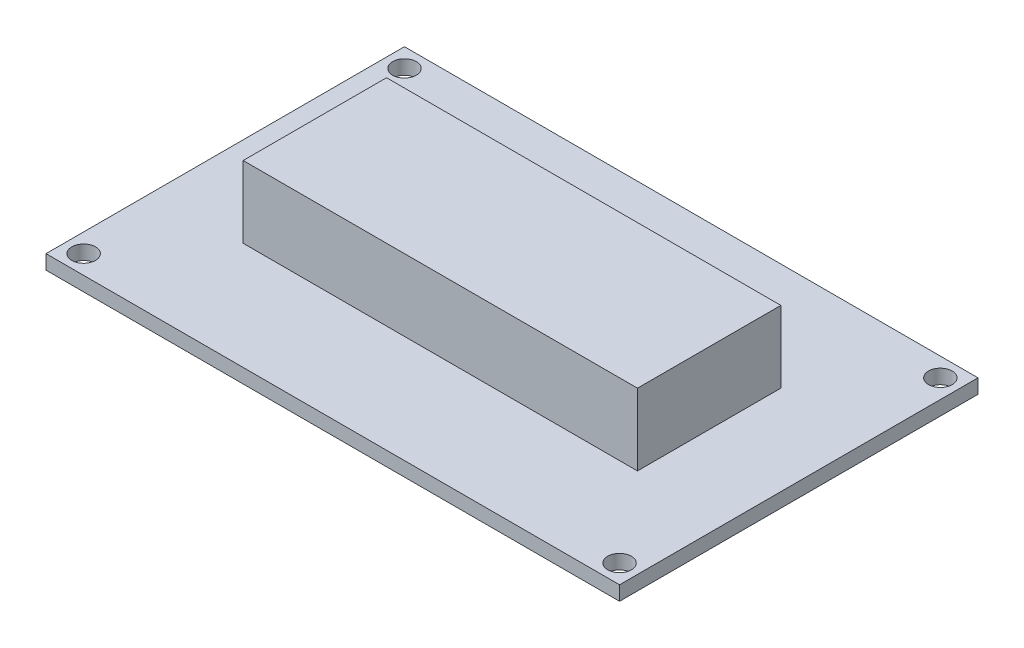
from build123d import *

# Parameters (mm, degrees)
SKETCH1_W           = 80
SKETCH1_H           = 50
SKETCH1_R           = 1.65
BOSS_EXTRUDE1_DEPTH = 2
SKETCH2_W           = 55
SKETCH2_H           = 20
BOSS_EXTRUDE2_DEPTH = 10


with BuildPart() as part:
    # Sketch1 → Boss-Extrude1 (new body)
    with BuildSketch(Plane(origin=(0, 0, 0), x_dir=(1, 0, 0), z_dir=(0, 1, 0))):
        with Locations((40, 25)):
            Rectangle(SKETCH1_W, SKETCH1_H)
        with Locations(Location((2.625, 2.625, 0), (0, 0, 270))):
            Circle(SKETCH1_R, mode=Mode.SUBTRACT)
        with Locations(Location((77.375, 2.625, 0), (0, 0, 270))):
            Circle(SKETCH1_R, mode=Mode.SUBTRACT)
        with Locations(Location((2.625, 47.375, 0), (0, 0, 270))):
            Circle(SKETCH1_R, mode=Mode.SUBTRACT)
        with Locations(Location((77.375, 47.375, 0), (0, 0, 270))):
            Circle(SKETCH1_R, mode=Mode.SUBTRACT)
    extrude(amount=BOSS_EXTRUDE1_DEPTH)

    # Sketch2 → Boss-Extrude2 (add)
    with BuildSketch(Plane(origin=(0, 2, 0), x_dir=(1, 0, 0), z_dir=(0, 1, 0))):
        with Locations((40, 25)):
            Rectangle(SKETCH2_W, SKETCH2_H)
    extrude(amount=BOSS_EXTRUDE2_DEPTH)


solid = part.part
